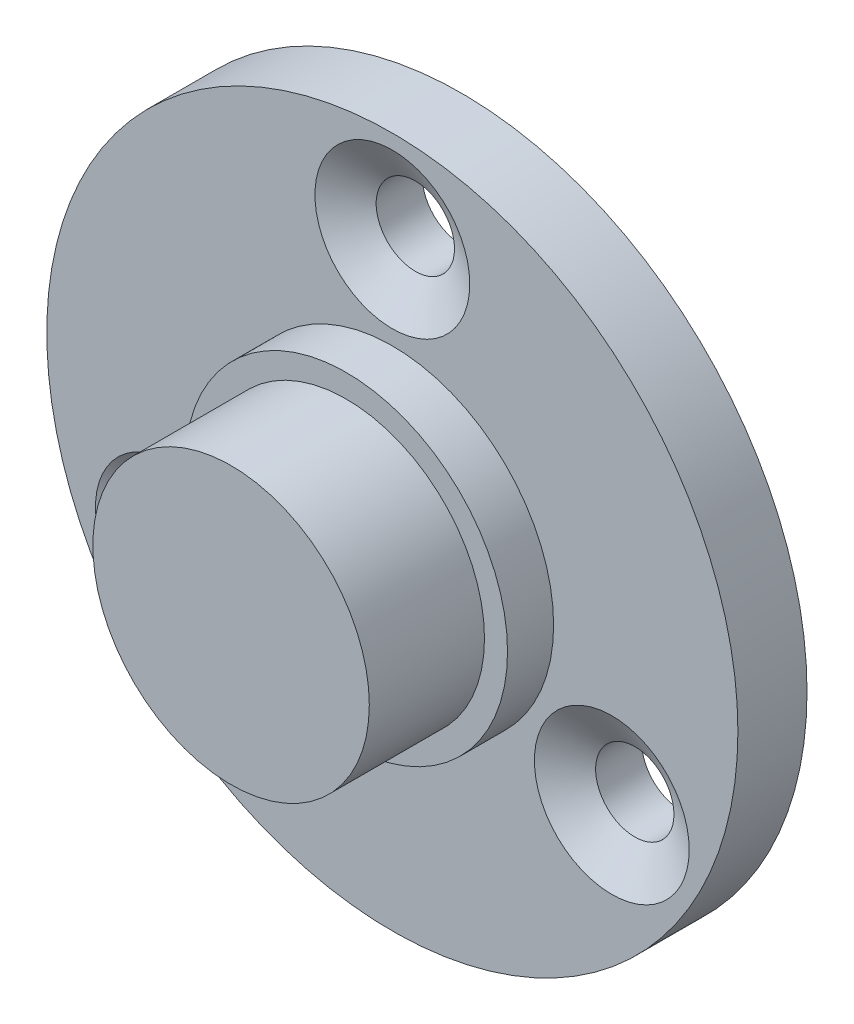
from build123d import *

# Parameters (mm, degrees)
SKETCH_1_R                   = 15
EXTRUDE_1_DEPTH              = 3
SKETCH_2_R                   = 6
EXTRUDE_2_DEPTH              = 7
HOLE_WIZARD_M3_1_D           = 3.4
HOLE_WIZARD_M3_1_DEPTH       = 14.54
HOLE_WIZARD_M3_1_CSINK_D     = 6.72
HOLE_WIZARD_M3_1_CSINK_ANGLE = 118
HOLE_WIZARD_M3_1_TIP         = 1.021463052
SKETCH_6_R                   = 7
SKETCH_6_R_2                 = 6
EXTRUDE_3_DEPTH              = 2


with BuildPart() as part:
    # 草图1 → 凸台-拉伸1 (new body)
    with BuildSketch(Plane.XY):
        Circle(SKETCH_1_R)
    extrude(amount=EXTRUDE_1_DEPTH)

    # 草图2 → 凸台-拉伸2 (add)
    with BuildSketch(Plane.XY.offset(3)):
        Circle(SKETCH_2_R)
    extrude(amount=EXTRUDE_2_DEPTH)

    # M3 六角凹锥坑螺钉的锥形沉头孔1
    with Locations(Plane(origin=(0, 11, 3), x_dir=(1, 0, 0), z_dir=(0, 0, 1))):
        with Locations((0, 0), (-9.526279442, -16.5), (9.526279442, -16.5)):
            CounterSinkHole(HOLE_WIZARD_M3_1_D / 2, HOLE_WIZARD_M3_1_CSINK_D / 2, depth=HOLE_WIZARD_M3_1_DEPTH, counter_sink_angle=HOLE_WIZARD_M3_1_CSINK_ANGLE)
            with Locations((0, 0, -(HOLE_WIZARD_M3_1_DEPTH + HOLE_WIZARD_M3_1_TIP / 2))):  # 118° drill point
                Cone(0, HOLE_WIZARD_M3_1_D / 2, HOLE_WIZARD_M3_1_TIP, mode=Mode.SUBTRACT)

    # 草图6 → 凸台-拉伸3 (add)
    with BuildSketch(Plane.XY.offset(3)):
        Circle(SKETCH_6_R)
        Circle(SKETCH_6_R_2, mode=Mode.SUBTRACT)
    extrude(amount=EXTRUDE_3_DEPTH)


solid = part.part
